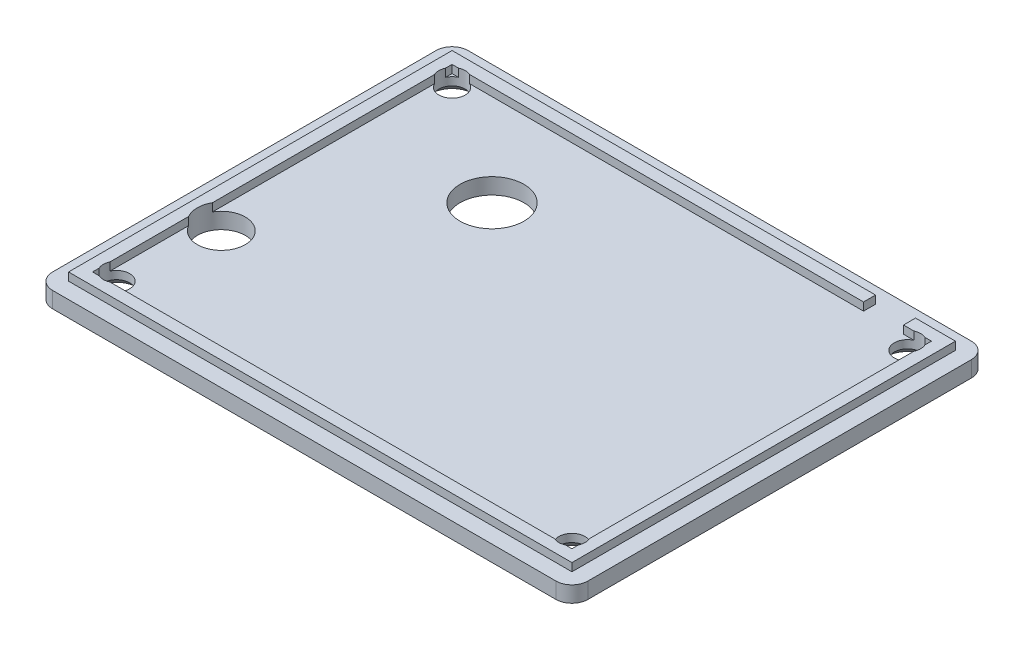
from build123d import *

# Parameters (mm, degrees)
SKETCH_1_W          = 67
SKETCH_1_H          = 52
SKETCH_1_W_2        = 60
SKETCH_1_H_2        = 45
EXTRUDE_1_DEPTH     = 2
SKETCH_2_W          = 60
SKETCH_2_H          = 45
EXTRUDE_2_DEPTH     = 1
SKETCH_3_W          = 60
SKETCH_3_H          = 45
EXTRUDE_3_DEPTH     = 2
SKETCH_4_W          = 5
SKETCH_4_H          = 1
CUT_EXTRUDE_1_DEPTH = 2
FILLET_1_R          = 2
SKETCH_6_R          = 1.65
CUT_EXTRUDE_3_DEPTH = 85.864598037
CHAMFER_1_SIZE      = 1
SKETCH_7_R          = 3
SKETCH_7_R_2        = 4
CUT_EXTRUDE_4_DEPTH = 10


with BuildPart() as part:
    # Эскиз1 → Бобышка-Вытянуть1 (new body)
    with BuildSketch(Plane(origin=(0, 0, 0), x_dir=(1, 0, 0), z_dir=(0, 1, 0))):
        with Locations((-33.5, 26)):
            Rectangle(SKETCH_1_W, SKETCH_1_H)
        with Locations((-33.5, 26)):
            Rectangle(SKETCH_1_W_2, SKETCH_1_H_2, mode=Mode.SUBTRACT)
    extrude(amount=EXTRUDE_1_DEPTH)

    # Эскиз2 → Бобышка-Вытянуть2 (add)
    with BuildSketch(Plane(origin=(0, 2, 0), x_dir=(1, 0, 0), z_dir=(0, 1, 0))):
        Polygon((-65, 50), (-65, 3.5), (-65, 2), (-2, 2), (-2, 50), align=None)
        with Locations((-33.5, 26)):
            Rectangle(SKETCH_2_W, SKETCH_2_H, mode=Mode.SUBTRACT)
    extrude(amount=EXTRUDE_2_DEPTH)

    # Эскиз3 → Бобышка-Вытянуть3 (add)
    with BuildSketch(Plane(origin=(0, 0, 0), x_dir=(-1, 0, 0), z_dir=(0, -1, 0))):
        with Locations((33.5, 26)):
            Rectangle(SKETCH_3_W, SKETCH_3_H)
    extrude(amount=-EXTRUDE_3_DEPTH)

    # Эскиз4 → Вырез-Вытянуть1 (cut)
    with BuildSketch(Plane(origin=(0, 0, -50), x_dir=(-1, 0, 0), z_dir=(0, 0, -1))):
        with Locations((9.5, 2.5)):
            Rectangle(SKETCH_4_W, SKETCH_4_H)
    extrude(amount=-CUT_EXTRUDE_1_DEPTH, mode=Mode.SUBTRACT)

    # Скругление1
    fillet_1_edges = [part.edges().sort_by_distance(p)[0] for p in [
        (-67, 1, -52),
        (0, 1, -52),
        (0, 1, 0),
        (-67, 1, 0),
    ]]
    fillet(fillet_1_edges, radius=FILLET_1_R)

    # Эскиз6 → Вырез-Вытянуть3 (cut, through all)
    with BuildSketch(Plane(origin=(0, 0, 0), x_dir=(-1, 0, 0), z_dir=(0, -1, 0))):
        with Locations(Location((62, 47, 0), (0, 0, 90))):
            Circle(SKETCH_6_R)
        with Locations(Location((62, 5, 0), (0, 0, 24.619977329))):
            Circle(SKETCH_6_R)
        with Locations(Location((5, 47, 0), (0, 0, 114.619977329))):
            Circle(SKETCH_6_R)
        with Locations(Location((5, 5, 0), (0, 0, 90))):
            Circle(SKETCH_6_R)
    extrude(amount=-CUT_EXTRUDE_3_DEPTH, mode=Mode.SUBTRACT)

    # Фаска1
    chamfer_1_edges = [part.edges().sort_by_distance(p)[0] for p in [
        (-62, 0, -45.35),
        (-60.5, 0, -4.312613646),
        (-5.687386354, 0, -45.5),
        (-5, 0, -3.35),
    ]]
    chamfer(chamfer_1_edges, length=CHAMFER_1_SIZE)

    # Эскиз7 → Вырез-Вытянуть4 (cut)
    with BuildSketch(Plane(origin=(0, 0, 0), x_dir=(-1, 0, 0), z_dir=(0, -1, 0))):
        with Locations(Location((60.899393258, 17.01932713, 0), (0, 0, 90))):
            Circle(SKETCH_7_R)
        with Locations(Location((47.004021418, 37, 0), (0, 0, 90))):
            Circle(SKETCH_7_R_2)
    extrude(amount=-CUT_EXTRUDE_4_DEPTH, mode=Mode.SUBTRACT)


solid = part.part
